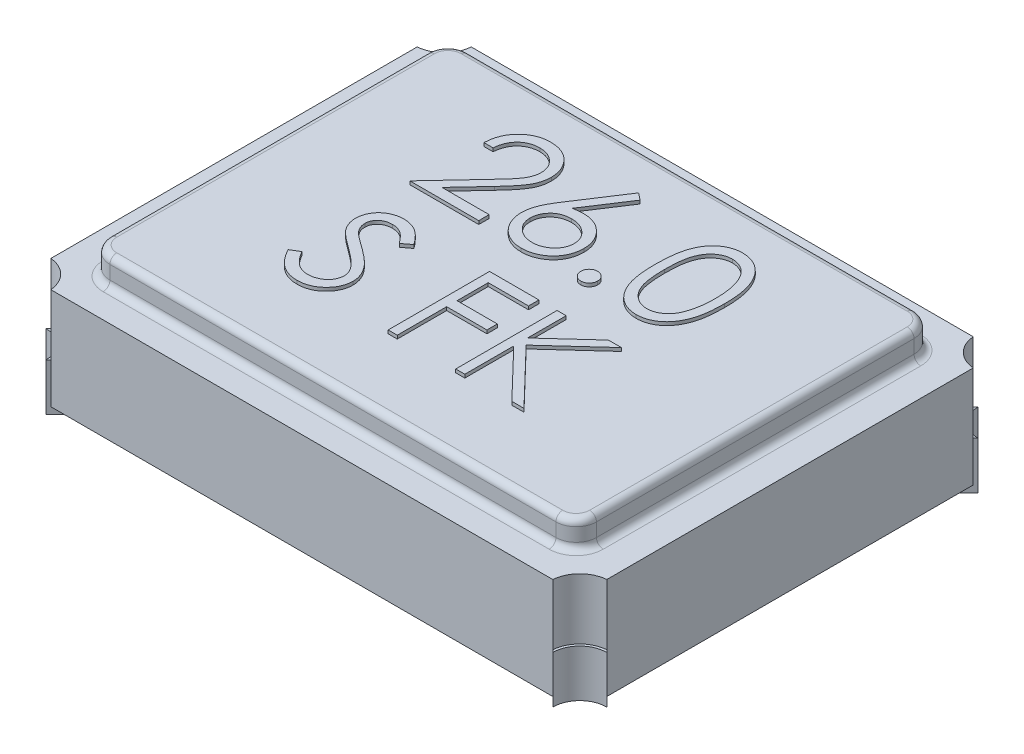
from build123d import *

# Parameters (mm, degrees)
EXTRUDE_2_DEPTH   = 0.02
EXTRUDE_2_2_DEPTH = 0.02
EXTRUDE_2_3_DEPTH = 0.02
EXTRUDE_2_4_DEPTH = 0.02
EXTRUDE_4_DEPTH   = 0.12
EXTRUDE_8_DEPTH   = 0.3
SKETCH_7_W        = 1.44
SKETCH_7_H        = 1.06
EXTRUDE_9_DEPTH   = 0.08
FILLET_3_R        = 0.06
FILLET_4_R        = 0.02
FILLET_5_R        = 0.02
EXTRUDE_10_DEPTH  = 0.01


with BuildPart() as part:
    # Эскиз2 → Бобышка-Вытянуть2 (new body)
    with BuildSketch(Plane(origin=(0, 0, 0), x_dir=(1, 0, 0), z_dir=(0, 1, 0))):
        with BuildLine():
            Line((-0.74501601, 0.156657181), (-0.74501601, 0.464330546))
            Line((-0.74501601, 0.464330546), (-0.83001601, 0.549330546))
            ThreePointArc((-0.83001601, 0.549330546), (-0.773447468, 0.572762004), (-0.75001601, 0.629330546))
            Line((-0.75001601, 0.629330546), (-0.662036749, 0.541351285))
            Line((-0.662036749, 0.541351285), (-0.26444153, 0.541351285))
            Line((-0.26444153, 0.541351285), (-0.26444153, 0.331410506))
            Line((-0.26444153, 0.331410506), (-0.439194854, 0.156657181))
            Line((-0.439194854, 0.156657181), (-0.74501601, 0.156657181))
        make_face()
    extrude(amount=EXTRUDE_2_DEPTH)



with BuildPart() as body_2:
    # Эскиз2 → Extrude 2 2 (new body)
    with BuildSketch(Plane(origin=(0, 0, 0), x_dir=(1, 0, 0), z_dir=(0, 1, 0))):
        with BuildLine():
            Line((0.75001601, 0.629330546), (0.662036749, 0.541351285))
            Line((0.662036749, 0.541351285), (0.26444153, 0.541351285))
            Line((0.26444153, 0.541351285), (0.26444153, 0.156657181))
            Line((0.26444153, 0.156657181), (0.74501601, 0.156657181))
            Line((0.74501601, 0.156657181), (0.74501601, 0.464330546))
            Line((0.74501601, 0.464330546), (0.83001601, 0.549330546))
            ThreePointArc((0.83001601, 0.549330546), (0.773447468, 0.572762004), (0.75001601, 0.629330546))
        make_face()
    extrude(amount=EXTRUDE_2_2_DEPTH)


with BuildPart() as body_3:
    # Эскиз2 → Extrude 2 3 (new body)
    with BuildSketch(Plane(origin=(0, 0, 0), x_dir=(1, 0, 0), z_dir=(0, 1, 0))):
        with BuildLine():
            Line((-0.75001601, -0.629330546), (-0.662036749, -0.541351285))
            Line((-0.662036749, -0.541351285), (-0.26444153, -0.541351285))
            Line((-0.26444153, -0.541351285), (-0.26444153, -0.156657181))
            Line((-0.26444153, -0.156657181), (-0.74501601, -0.156657181))
            Line((-0.74501601, -0.156657181), (-0.74501601, -0.464330546))
            Line((-0.74501601, -0.464330546), (-0.83001601, -0.549330546))
            ThreePointArc((-0.83001601, -0.549330546), (-0.773447468, -0.572762004), (-0.75001601, -0.629330546))
        make_face()
    extrude(amount=EXTRUDE_2_3_DEPTH)


with BuildPart() as body_4:
    # Эскиз2 → Extrude 2 4 (new body)
    with BuildSketch(Plane(origin=(0, 0, 0), x_dir=(1, 0, 0), z_dir=(0, 1, 0))):
        with BuildLine():
            Line((0.26444153, -0.156657181), (0.26444153, -0.541351285))
            Line((0.26444153, -0.541351285), (0.662036749, -0.541351285))
            Line((0.662036749, -0.541351285), (0.75001601, -0.629330546))
            ThreePointArc((0.75001601, -0.629330546), (0.773447468, -0.572762004), (0.83001601, -0.549330546))
            Line((0.83001601, -0.549330546), (0.74501601, -0.464330546))
            Line((0.74501601, -0.464330546), (0.74501601, -0.156657181))
            Line((0.74501601, -0.156657181), (0.26444153, -0.156657181))
        make_face()
    extrude(amount=EXTRUDE_2_4_DEPTH)


with BuildPart() as part_1:
    add(part.part)

    add(body_2.part)  # Бобышка-Вытянуть4 merges body 2

    add(body_3.part)  # Бобышка-Вытянуть4 merges body 3

    add(body_4.part)  # Бобышка-Вытянуть4 merges body 4
    # Эскиз5 → Бобышка-Вытянуть4 (add)
    with BuildSketch(Plane(origin=(0, 0.02, 0), x_dir=(-1, 0, 0), z_dir=(0, 1, 0))):
        with BuildLine():
            Line((0.75001601, -0.629330546), (0.742944942, -0.622259479))
            ThreePointArc((0.742944942, -0.622259479), (0.768244775, -0.567559312), (0.822944942, -0.542259479))
            Line((0.822944942, -0.542259479), (0.83001601, -0.549330546))
            ThreePointArc((0.83001601, -0.549330546), (0.773447468, -0.572762004), (0.75001601, -0.629330546))
        make_face()
        with BuildLine():
            Line((-0.83001601, -0.549330546), (-0.822944942, -0.542259479))
            ThreePointArc((-0.822944942, -0.542259479), (-0.768244775, -0.567559312), (-0.742944942, -0.622259479))
            Line((-0.742944942, -0.622259479), (-0.75001601, -0.629330546))
            ThreePointArc((-0.75001601, -0.629330546), (-0.773447468, -0.572762004), (-0.83001601, -0.549330546))
        make_face()
        with BuildLine():
            Line((-0.75001601, 0.629330546), (-0.742944942, 0.622259479))
            ThreePointArc((-0.742944942, 0.622259479), (-0.768244775, 0.567559312), (-0.822944942, 0.542259479))
            Line((-0.822944942, 0.542259479), (-0.83001601, 0.549330546))
            ThreePointArc((-0.83001601, 0.549330546), (-0.773447468, 0.572762004), (-0.75001601, 0.629330546))
        make_face()
        with BuildLine():
            Line((0.83001601, 0.549330546), (0.822944942, 0.542259479))
            ThreePointArc((0.822944942, 0.542259479), (0.768244775, 0.567559312), (0.742944942, 0.622259479))
            Line((0.742944942, 0.622259479), (0.75001601, 0.629330546))
            ThreePointArc((0.75001601, 0.629330546), (0.773447468, 0.572762004), (0.83001601, 0.549330546))
        make_face()
    extrude(amount=EXTRUDE_4_DEPTH)

    # Эскиз6 → Бобышка-Вытянуть8 (add)
    with BuildSketch(Plane(origin=(0, 0.02, 0), x_dir=(-1, 0, 0), z_dir=(0, 1, 0))):
        with BuildLine():
            Line((0.822944942, -0.542259479), (0.822944942, 0.542259479))
            ThreePointArc((0.822944942, 0.542259479), (0.768244775, 0.567559312), (0.742944942, 0.622259479))
            Line((0.742944942, 0.622259479), (-0.742944942, 0.622259479))
            ThreePointArc((-0.742944942, 0.622259479), (-0.768244775, 0.567559312), (-0.822944942, 0.542259479))
            Line((-0.822944942, 0.542259479), (-0.822944942, -0.542259479))
            ThreePointArc((-0.822944942, -0.542259479), (-0.768244775, -0.567559312), (-0.742944942, -0.622259479))
            Line((-0.742944942, -0.622259479), (0.742944942, -0.622259479))
            ThreePointArc((0.742944942, -0.622259479), (0.768244775, -0.567559312), (0.822944942, -0.542259479))
        make_face()
    extrude(amount=EXTRUDE_8_DEPTH)

    # Эскиз7 → Бобышка-Вытянуть9 (add)
    with BuildSketch(Plane(origin=(0, 0.32, 0), x_dir=(-1, 0, 0), z_dir=(0, 1, 0))):
        Rectangle(SKETCH_7_W, SKETCH_7_H)
    extrude(amount=EXTRUDE_9_DEPTH)

    # Скругление3
    fillet_3_edges = [part_1.edges().sort_by_distance(p)[0] for p in [
        (-0.72, 0.36, -0.53),
        (-0.72, 0.36, 0.53),
        (0.72, 0.36, 0.53),
        (0.72, 0.36, -0.53),
    ]]
    fillet(fillet_3_edges, radius=FILLET_3_R)

    # Скругление4
    fillet_4_edges = [part_1.edges().sort_by_distance(p)[0] for p in [
        (0, 0.4, -0.53),
        (0.72, 0.4, 0),
        (-0.72, 0.4, 0),
        (0, 0.4, 0.53),
        (-0.702426407, 0.4, 0.512426407),
        (-0.702426407, 0.4, -0.512426407),
        (0.702426407, 0.4, 0.512426407),
        (0.702426407, 0.4, -0.512426407),
    ]]
    fillet(fillet_4_edges, radius=FILLET_4_R)

    # Скругление5
    fillet_5_edges = [part_1.edges().sort_by_distance(p)[0] for p in [
        (0, 0.32, -0.53),
        (0.72, 0.32, 0),
        (0, 0.32, 0.53),
        (-0.72, 0.32, 0),
        (0.702426407, 0.32, -0.512426407),
        (0.702426407, 0.32, 0.512426407),
        (-0.702426407, 0.32, -0.512426407),
        (-0.702426407, 0.32, 0.512426407),
    ]]
    fillet(fillet_5_edges, radius=FILLET_5_R)

    # Эскиз8 → Бобышка-Вытянуть10 (add)
    # profile 1 of 7: a face of its own
    with BuildSketch(Plane(origin=(0, 0.4, 0), x_dir=(-1, 0, 0), z_dir=(0, 1, 0))):
        with BuildLine():
            Line((0.404202139, 0.258273988), (0.378841562, 0.243069661))
            add(Edge.make_bspline(
                [(0.378841562, 0.243069661), (0.376482856, 0.247018037), (0.371963666, 0.254582973), (0.364424978, 0.264805091), (0.356613586, 0.273493276), (0.348471643, 0.280596985), (0.340048848, 0.286189746), (0.331290214, 0.290149938), (0.322225259, 0.292619878), (0.316056075, 0.292919886), (0.312976178, 0.293069661)],
                knots=[0, 0, 0, 0, 1.272034388, 2.437168799, 3.508375237, 4.49857839, 5.41946034, 6.295179144, 7.148887113, 8, 8, 8, 8], degree=3))
            add(Edge.make_bspline(
                [(0.312976178, 0.293069661), (0.310346407, 0.292994661), (0.305132882, 0.292845972), (0.297442695, 0.291474988), (0.290011336, 0.289232068), (0.282912768, 0.286191521), (0.276334729, 0.282454119), (0.27047482, 0.2780467), (0.265523603, 0.272955223), (0.26143029, 0.267363266), (0.258225977, 0.261387555), (0.255946032, 0.255175256), (0.254481445, 0.248765956), (0.254295756, 0.244419583), (0.254202139, 0.242228315)],
                knots=[0, 0, 0, 0, 1.095645842, 2.172120455, 3.244862764, 4.326153987, 5.384857088, 6.392105572, 7.372507978, 8.334705661, 9.272564127, 10.189475455, 11.087205874, 12, 12, 12, 12], degree=3))
            add(Edge.make_bspline(
                [(0.254202139, 0.242228315), (0.254325794, 0.239729694), (0.25457621, 0.234669715), (0.256783139, 0.227191536), (0.260153027, 0.219759057), (0.263320343, 0.215160723), (0.264959351, 0.2127812)],
                knots=[0, 0, 0, 0, 0.938992559, 1.901562324, 2.914110574, 4, 4, 4, 4], degree=3))
            add(Edge.make_bspline(
                [(0.264959351, 0.2127812), (0.266298546, 0.21105917), (0.269118272, 0.207433373), (0.274037181, 0.202131026), (0.27963029, 0.196516819), (0.286042407, 0.190702812), (0.29318003, 0.184570072), (0.301124079, 0.178232341), (0.309781795, 0.171595093), (0.315888334, 0.167211381), (0.319045889, 0.164944661)],
                knots=[0, 0, 0, 0, 0.722283655, 1.520795216, 2.39349503, 3.346893347, 4.386874146, 5.510198126, 6.712579003, 8, 8, 8, 8], degree=3))
            add(Edge.make_bspline(
                [(0.319045889, 0.164944661), (0.322201811, 0.162695982), (0.328235692, 0.158396679), (0.336680442, 0.152024107), (0.344221783, 0.146160636), (0.350898142, 0.140887944), (0.356536792, 0.135976061), (0.361343867, 0.131688237), (0.365142017, 0.127795506), (0.367255597, 0.125272252), (0.368204543, 0.124139373)],
                knots=[0, 0, 0, 0, 1.452255772, 2.776602448, 3.96446981, 5.032613149, 5.964194703, 6.766668629, 7.446264616, 8, 8, 8, 8], degree=3))
            add(Edge.make_bspline(
                [(0.368204543, 0.124139373), (0.369530539, 0.122373482), (0.372138288, 0.118900621), (0.375584256, 0.113474025), (0.37849025, 0.107929589), (0.380829032, 0.102247219), (0.382720316, 0.09646962), (0.384035244, 0.090553418), (0.384845738, 0.084538775), (0.38492946, 0.080492044), (0.38497137, 0.078466296)],
                knots=[0, 0, 0, 0, 1.068019517, 2.100403715, 3.106014851, 4.09224787, 5.069873182, 6.043214339, 7.020455327, 8, 8, 8, 8], degree=3))
            add(Edge.make_bspline(
                [(0.38497137, 0.078466296), (0.384859988, 0.075292043), (0.384639604, 0.069011385), (0.382760408, 0.05984126), (0.379829366, 0.051059099), (0.375588822, 0.042860362), (0.370350956, 0.035256672), (0.364133599, 0.02838291), (0.356820317, 0.022475681), (0.348678768, 0.017454064), (0.339871289, 0.013447934), (0.330615145, 0.010528817), (0.320951928, 0.008818036), (0.314385131, 0.008576721), (0.311053101, 0.008454277)],
                knots=[0, 0, 0, 0, 1.005367131, 1.989245246, 2.955191616, 3.932180104, 4.904534562, 5.875498653, 6.859376768, 7.874484044, 8.900379497, 9.918679785, 10.943926428, 12, 12, 12, 12], degree=3))
            add(Edge.make_bspline(
                [(0.311053101, 0.008454277), (0.3075168, 0.00857228), (0.300503892, 0.008806293), (0.290185218, 0.010966122), (0.280191117, 0.014321933), (0.27218163, 0.018318638), (0.26591072, 0.022267377), (0.261133506, 0.025873167), (0.256266095, 0.030015346), (0.251360932, 0.034781662), (0.246369551, 0.04007666), (0.241314957, 0.045945198), (0.236149844, 0.052334382), (0.2328281, 0.056896677), (0.231125216, 0.059235527)],
                knots=[0, 0, 0, 0, 1.286534051, 2.551350862, 3.822568981, 5.117864672, 5.799956111, 6.519305446, 7.295594771, 8.126302591, 9.008831062, 9.944975596, 10.946496709, 12, 12, 12, 12], degree=3))
            Line((0.231125216, 0.059235527), (0.255464158, 0.077685046))
            add(Edge.make_bspline(
                [(0.255464158, 0.077685046), (0.256933703, 0.07579162), (0.259763701, 0.072145324), (0.26406194, 0.06704067), (0.268106993, 0.062371459), (0.27212285, 0.058326561), (0.275799955, 0.054603035), (0.279432226, 0.051471778), (0.282879343, 0.048833381), (0.287214476, 0.046014028), (0.292720108, 0.043286283), (0.299566881, 0.040941072), (0.306726675, 0.039499801), (0.311587301, 0.039316618), (0.314057908, 0.039223507)],
                knots=[0, 0, 0, 0, 1.181426797, 2.275151783, 3.28963443, 4.225459815, 5.084396437, 5.868484344, 6.587427557, 7.222918358, 8.415355282, 9.605213164, 10.782753814, 12, 12, 12, 12], degree=3))
            add(Edge.make_bspline(
                [(0.314057908, 0.039223507), (0.31715777, 0.039325667), (0.323135562, 0.039522671), (0.331602504, 0.041730875), (0.339267199, 0.0450883), (0.34583705, 0.049929671), (0.351261673, 0.055701518), (0.355234333, 0.062283903), (0.357609516, 0.069553891), (0.357900235, 0.074622775), (0.358048293, 0.077204277)],
                knots=[0, 0, 0, 0, 1.144248881, 2.206576175, 3.214949548, 4.222996039, 5.203671638, 6.127710127, 7.046472867, 8, 8, 8, 8], degree=3))
            add(Edge.make_bspline(
                [(0.358048293, 0.077204277), (0.358011079, 0.078810755), (0.357936133, 0.082046092), (0.357042592, 0.086816254), (0.35570917, 0.091530261), (0.353819081, 0.096215271), (0.351250428, 0.101004757), (0.347761746, 0.10587142), (0.343396123, 0.110937059), (0.340045622, 0.114228509), (0.338276658, 0.115966296)],
                knots=[0, 0, 0, 0, 0.858500039, 1.728959331, 2.587258638, 3.476905708, 4.426389682, 5.487945037, 6.673710648, 8, 8, 8, 8], degree=3))
            add(Edge.make_bspline(
                [(0.338276658, 0.115966296), (0.337619969, 0.116552327), (0.336059826, 0.117944602), (0.333207604, 0.12022394), (0.329441079, 0.123035606), (0.324858604, 0.126514519), (0.319375688, 0.130550073), (0.312991726, 0.135090668), (0.30577788, 0.140283708), (0.300658859, 0.143914354), (0.297952139, 0.145834084)],
                knots=[0, 0, 0, 0, 0.420754252, 0.999615792, 1.744751191, 2.668019286, 3.750313428, 4.999500688, 6.413464383, 8, 8, 8, 8], degree=3))
            add(Edge.make_bspline(
                [(0.297952139, 0.145834084), (0.294696206, 0.148203345), (0.288391543, 0.152791091), (0.279420862, 0.159683841), (0.271287213, 0.166425156), (0.263961439, 0.172971548), (0.25737318, 0.179274823), (0.25158885, 0.185405929), (0.246582205, 0.191324659), (0.241118583, 0.198861238), (0.235601945, 0.208203103), (0.230871881, 0.21965381), (0.227862695, 0.231137376), (0.227471885, 0.238845739), (0.227279062, 0.242648988)],
                knots=[0, 0, 0, 0, 1.163604038, 2.253157948, 3.268574773, 4.215621239, 5.091738613, 5.902582348, 6.650434646, 7.330118262, 8.591011492, 9.77460283, 10.902005569, 12, 12, 12, 12], degree=3))
            add(Edge.make_bspline(
                [(0.227279062, 0.242648988), (0.227335477, 0.245338513), (0.227447211, 0.250665333), (0.228728285, 0.258487919), (0.230611912, 0.266082163), (0.233419231, 0.273353556), (0.236928461, 0.28038314), (0.241200921, 0.287158589), (0.246378656, 0.293568575), (0.252130498, 0.299737581), (0.258519339, 0.305316837), (0.265280038, 0.310286193), (0.272374647, 0.314541067), (0.279884187, 0.31788379), (0.287684955, 0.320557682), (0.295813567, 0.322474258), (0.304287491, 0.323654547), (0.310047616, 0.323776758), (0.312976178, 0.323838892)],
                knots=[0, 0, 0, 0, 0.98378539, 1.948466333, 2.894822735, 3.844243623, 4.795447569, 5.768042124, 6.770299647, 7.807997672, 8.852593179, 9.870666288, 10.876941106, 11.874841786, 12.874492863, 13.892063892, 14.928283473, 16, 16, 16, 16], degree=3))
            add(Edge.make_bspline(
                [(0.312976178, 0.323838892), (0.315241964, 0.323794574), (0.319745002, 0.323706497), (0.326387662, 0.322946286), (0.332908342, 0.321831427), (0.339225169, 0.320131672), (0.345416792, 0.31802084), (0.351428048, 0.315436452), (0.357273438, 0.312359797), (0.362960183, 0.308786115), (0.368540331, 0.304666499), (0.373991364, 0.299909969), (0.379340568, 0.294539291), (0.384610163, 0.28856194), (0.389676017, 0.281879114), (0.394665522, 0.274596795), (0.399552697, 0.266691457), (0.402623378, 0.261132218), (0.404202139, 0.258273988)],
                knots=[0, 0, 0, 0, 0.915366252, 1.81920441, 2.69897508, 3.586533125, 4.459536084, 5.340758185, 6.227946952, 7.126403341, 8.052553006, 9.028121456, 10.047063623, 11.114014537, 12.24582441, 13.433687931, 14.680555077, 16, 16, 16, 16], degree=3))
        make_face()
    # profile 2 of 7: a face of its own
    with BuildSketch(Plane(origin=(0, 0.4, 0), x_dir=(-1, 0, 0), z_dir=(0, 1, 0))):
        Polygon((0.050355985, 0.016146584), (-0.095797861, 0.016146584), (-0.095797861, 0.046915815), (0.023432908, 0.046915815), (0.023432908, 0.139223507), (-0.095797861, 0.139223507), (-0.095797861, 0.169992738), (0.023432908, 0.169992738), (0.023432908, 0.316146584), (0.050355985, 0.316146584), align=None)
    # profile 3 of 7: a face of its own
    with BuildSketch(Plane(origin=(0, 0.4, 0), x_dir=(-1, 0, 0), z_dir=(0, 1, 0))):
        Polygon((-0.149644015, 0.016146584), (-0.176567092, 0.016146584), (-0.176567092, 0.130389373), (-0.301627188, 0.016146584), (-0.34002863, 0.016146584), (-0.192612765, 0.150761969), (-0.351567092, 0.316146584), (-0.315689688, 0.316146584), (-0.176567092, 0.17137495), (-0.176567092, 0.316146584), (-0.149644015, 0.316146584), align=None)
    # profile 4 of 7: a face of its own
    with BuildSketch(Plane(origin=(0, 0.4, 0), x_dir=(-1, 0, 0), z_dir=(0, 1, 0))):
        with BuildLine():
            Line((0.361894447, -0.305791791), (0.388817524, -0.305791791))
            add(Edge.make_bspline(
                [(0.388817524, -0.305791791), (0.388642083, -0.309363599), (0.388297523, -0.316378535), (0.386683247, -0.326606049), (0.384375559, -0.336383077), (0.381105026, -0.345625797), (0.377066203, -0.354444622), (0.372121516, -0.362722448), (0.366376376, -0.370541433), (0.359841324, -0.377753535), (0.35275019, -0.384346298), (0.345145461, -0.390099734), (0.3371053, -0.394905207), (0.328699443, -0.398944318), (0.319830674, -0.40197248), (0.310583768, -0.404220313), (0.300916931, -0.405572499), (0.294330651, -0.405717862), (0.290980985, -0.405791791)],
                knots=[0, 0, 0, 0, 1.100776268, 2.161895295, 3.184016182, 4.190939212, 5.176500551, 6.166955529, 7.155448256, 8.160289653, 9.16017456, 10.133824356, 11.091467644, 12.04088621, 13.000931625, 13.972173743, 14.968683325, 16, 16, 16, 16], degree=3))
            add(Edge.make_bspline(
                [(0.290980985, -0.405791791), (0.287691205, -0.405715406), (0.281226903, -0.405565311), (0.271796291, -0.404256953), (0.262797225, -0.402252012), (0.254331692, -0.399281004), (0.246312812, -0.39555304), (0.238839871, -0.390916828), (0.231732167, -0.385591738), (0.225338532, -0.379310533), (0.219465207, -0.372608472), (0.214402756, -0.365450727), (0.210042934, -0.358049398), (0.206474555, -0.35034667), (0.203769566, -0.34231746), (0.201765428, -0.334038746), (0.200619754, -0.325414985), (0.200444888, -0.319577113), (0.200355985, -0.316609099)],
                knots=[0, 0, 0, 0, 1.111674182, 2.184400057, 3.212814286, 4.223731311, 5.211378316, 6.196328225, 7.191884489, 8.207283132, 9.220262353, 10.201199469, 11.166417575, 12.120932471, 13.06540007, 14.026332106, 14.996573967, 16, 16, 16, 16], degree=3))
            add(Edge.make_bspline(
                [(0.200355985, -0.316609099), (0.200501124, -0.312430715), (0.200788856, -0.304147272), (0.203250054, -0.291974543), (0.207094168, -0.280180921), (0.211722103, -0.270688829), (0.216392088, -0.263040968), (0.220596213, -0.256740988), (0.225545826, -0.249959389), (0.231198641, -0.242668721), (0.237652006, -0.234964463), (0.244738264, -0.226689426), (0.252640421, -0.217996623), (0.258181732, -0.212055453), (0.261053101, -0.208976887)],
                knots=[0, 0, 0, 0, 1.184416499, 2.348048165, 3.509039915, 4.696071444, 5.333504901, 6.05069495, 6.844171097, 7.714965912, 8.667477798, 9.695072654, 10.805644396, 12, 12, 12, 12], degree=3))
            Line((0.261053101, -0.208976887), (0.336113197, -0.128868714))
            Line((0.336113197, -0.128868714), (0.196509831, -0.128868714))
            Line((0.196509831, -0.128868714), (0.196509831, -0.098099484))
            Line((0.196509831, -0.098099484), (0.400355985, -0.098099484))
            Line((0.400355985, -0.098099484), (0.284009831, -0.222258137))
            add(Edge.make_bspline(
                [(0.284009831, -0.222258137), (0.281176955, -0.225214974), (0.275735579, -0.230894451), (0.268042568, -0.239188827), (0.261121893, -0.246874599), (0.254968963, -0.253985824), (0.249578715, -0.260482189), (0.244968396, -0.266414603), (0.241117629, -0.271732158), (0.237036618, -0.277978998), (0.233145104, -0.285615072), (0.229724861, -0.294899815), (0.227654292, -0.304478866), (0.22740464, -0.310950144), (0.227279062, -0.314205253)],
                knots=[0, 0, 0, 0, 1.329530082, 2.553755191, 3.672934919, 4.687409497, 5.60679272, 6.413407421, 7.126401618, 7.737995624, 8.834647426, 9.90044882, 10.943907757, 12, 12, 12, 12], degree=3))
            add(Edge.make_bspline(
                [(0.227279062, -0.314205253), (0.227332995, -0.316252456), (0.227439285, -0.3202871), (0.228395119, -0.326198634), (0.229799429, -0.331923108), (0.231963904, -0.337389744), (0.234564441, -0.342706058), (0.237886819, -0.34771042), (0.241683425, -0.352573415), (0.246087301, -0.357128296), (0.250921939, -0.361301273), (0.256030184, -0.364997544), (0.261434435, -0.368086632), (0.267112171, -0.370618926), (0.273047494, -0.372605389), (0.279251902, -0.373981838), (0.285708246, -0.374846051), (0.290116831, -0.37496298), (0.292363197, -0.37502256)],
                knots=[0, 0, 0, 0, 0.991504627, 1.954065223, 2.895985987, 3.842598665, 4.797835564, 5.759220273, 6.74786863, 7.784730864, 8.824135544, 9.839918996, 10.835834653, 11.835434876, 12.84861661, 13.863796685, 14.911511676, 16, 16, 16, 16], degree=3))
            add(Edge.make_bspline(
                [(0.292363197, -0.37502256), (0.294709867, -0.374963709), (0.299318341, -0.374848134), (0.306070061, -0.373972174), (0.312556063, -0.372645576), (0.318676399, -0.370533643), (0.324559157, -0.368061901), (0.330054266, -0.364861431), (0.335316089, -0.361204399), (0.340238836, -0.356940531), (0.344722395, -0.352127267), (0.348801129, -0.346888114), (0.35225708, -0.341130192), (0.355324893, -0.334991666), (0.357671165, -0.328303883), (0.359677059, -0.321230402), (0.361134111, -0.313670301), (0.361636792, -0.308461579), (0.361894447, -0.305791791)],
                knots=[0, 0, 0, 0, 1.031072318, 2.024855787, 2.988461151, 3.935103592, 4.865765533, 5.788564469, 6.724086513, 7.67908574, 8.64457978, 9.611397706, 10.591395687, 11.591555111, 12.622101007, 13.700900657, 14.821571223, 16, 16, 16, 16], degree=3))
        make_face()
    # profile 5 of 7: a face of its own
    with BuildSketch(Plane(origin=(0, 0.4, 0), x_dir=(-1, 0, 0), z_dir=(0, 1, 0))):
        with BuildLine():
            Line((0.031125216, -0.405791791), (0.010392043, -0.389505734))
            Line((0.010392043, -0.389505734), (0.08965887, -0.268291791))
            add(Edge.make_bspline(
                [(0.08965887, -0.268291791), (0.084381418, -0.269132979), (0.07408715, -0.270773812), (0.063667216, -0.271044493), (0.058589158, -0.271176407)],
                knots=[0, 0, 0, 0, 1.025318673, 2, 2, 2, 2], degree=3))
            add(Edge.make_bspline(
                [(0.058589158, -0.271176407), (0.055540087, -0.271094454), (0.049538081, -0.270933133), (0.04072607, -0.26969166), (0.032258447, -0.267735222), (0.02417031, -0.264883314), (0.016432621, -0.261240257), (0.009001004, -0.256874061), (0.002015052, -0.251559317), (-0.004614799, -0.24562221), (-0.010635195, -0.239046881), (-0.015961206, -0.232068131), (-0.020459467, -0.22468651), (-0.024043256, -0.21690368), (-0.026907339, -0.208780563), (-0.028946217, -0.200285479), (-0.030165089, -0.191404089), (-0.030329652, -0.185362922), (-0.030413245, -0.182294195)],
                knots=[0, 0, 0, 0, 1.043709831, 2.054511743, 3.041122595, 4.01515914, 4.98481438, 5.965901842, 6.960491961, 7.985277438, 9.0096037, 10.00832444, 10.987059228, 11.962929573, 12.936966118, 13.931840027, 14.949438142, 16, 16, 16, 16], degree=3))
            add(Edge.make_bspline(
                [(-0.030413245, -0.182294195), (-0.03025698, -0.178098275), (-0.029949668, -0.169846565), (-0.027704156, -0.157780435), (-0.023857475, -0.146384344), (-0.018628363, -0.135628534), (-0.011973185, -0.125738257), (-0.003990802, -0.116829821), (0.005279376, -0.109064874), (0.015652775, -0.102406567), (0.026878498, -0.09711579), (0.038649436, -0.093204406), (0.05086449, -0.09086721), (0.05916021, -0.090561226), (0.063336755, -0.090407176)],
                knots=[0, 0, 0, 0, 1.0319111, 2.029359566, 3.00642934, 3.98275322, 4.962714161, 5.929339302, 6.915525103, 7.928435063, 8.953439721, 9.960121214, 10.9730072, 12, 12, 12, 12], degree=3))
            add(Edge.make_bspline(
                [(0.063336755, -0.090407176), (0.067373785, -0.090537792), (0.075370436, -0.090796521), (0.087130751, -0.093113336), (0.098451045, -0.096841763), (0.109185746, -0.10208614), (0.119147085, -0.108598214), (0.128127439, -0.116384503), (0.13589957, -0.125450058), (0.142391247, -0.135625713), (0.147703618, -0.146473888), (0.151415451, -0.157908514), (0.153828778, -0.169692613), (0.154077129, -0.177715109), (0.154202139, -0.18175333)],
                knots=[0, 0, 0, 0, 1.01206923, 2.004731945, 2.994948482, 3.995280086, 4.993424783, 5.973125358, 6.967517142, 7.97830003, 8.994392566, 9.989381197, 10.98793077, 12, 12, 12, 12], degree=3))
            add(Edge.make_bspline(
                [(0.154202139, -0.18175333), (0.154093415, -0.18484174), (0.15387152, -0.191144879), (0.152547275, -0.200718774), (0.150118449, -0.210476537), (0.147489928, -0.21874845), (0.144881642, -0.225599092), (0.142463179, -0.231008864), (0.139759042, -0.236721757), (0.136589418, -0.242629676), (0.13322936, -0.248901426), (0.129304431, -0.255304743), (0.125208708, -0.262073496), (0.122208285, -0.266580026), (0.120668485, -0.268892753)],
                knots=[0, 0, 0, 0, 1.17367173, 2.395347028, 3.66355231, 4.98980831, 5.690886799, 6.447442954, 7.240630024, 8.091733897, 8.994365608, 9.943299771, 10.944512865, 12, 12, 12, 12], degree=3))
            Line((0.120668485, -0.268892753), (0.031125216, -0.405791791))
        make_face()
        with BuildLine():
            add(Edge.make_bspline(
                [(0.064238197, -0.240407176), (0.066523686, -0.240340252), (0.071007798, -0.240208948), (0.0775745, -0.239450993), (0.083793177, -0.238063722), (0.089653622, -0.236111001), (0.095242326, -0.23372528), (0.100470517, -0.230699891), (0.105373379, -0.2271421), (0.109837691, -0.223047131), (0.113938107, -0.218632161), (0.117464864, -0.213874225), (0.120510432, -0.208919604), (0.122985808, -0.203721491), (0.124913585, -0.198283282), (0.126307991, -0.192629615), (0.127084031, -0.186722679), (0.127213136, -0.182717035), (0.127279062, -0.180671599)],
                knots=[0, 0, 0, 0, 1.129540697, 2.216149546, 3.260829642, 4.271906843, 5.264942922, 6.258225651, 7.250175744, 8.252297429, 9.247108021, 10.223125336, 11.173816288, 12.116901384, 13.062424938, 14.020354563, 14.989116641, 16, 16, 16, 16], degree=3))
            add(Edge.make_bspline(
                [(0.127279062, -0.180671599), (0.127223335, -0.178644889), (0.127113517, -0.174651008), (0.12618283, -0.168787072), (0.124684714, -0.163162115), (0.122555032, -0.157764272), (0.119834306, -0.15260175), (0.116580175, -0.147612141), (0.11263426, -0.142928261), (0.108151619, -0.138521203), (0.103280711, -0.134488386), (0.098140093, -0.130882808), (0.09271132, -0.127890107), (0.087052207, -0.125388634), (0.081091658, -0.123550878), (0.07493061, -0.122142947), (0.068484165, -0.121373435), (0.06411985, -0.121242945), (0.061894447, -0.121176407)],
                knots=[0, 0, 0, 0, 0.98953633, 1.950002717, 2.892353065, 3.828177645, 4.777967117, 5.738732544, 6.732276577, 7.76327951, 8.805689376, 9.818183401, 10.825652611, 11.829169732, 12.834974292, 13.867693979, 14.912718532, 16, 16, 16, 16], degree=3))
            add(Edge.make_bspline(
                [(0.061894447, -0.121176407), (0.05966904, -0.12124294), (0.055304718, -0.12137342), (0.048858324, -0.122143006), (0.042697085, -0.123550664), (0.036737232, -0.125389408), (0.031075537, -0.127887217), (0.025642015, -0.130901672), (0.020452314, -0.134466528), (0.015584574, -0.138528177), (0.011083225, -0.142903261), (0.007227982, -0.147654956), (0.003868906, -0.152562482), (0.001251941, -0.157784806), (-0.000901586, -0.163158905), (-0.002392363, -0.168787948), (-0.003325034, -0.17465078), (-0.003434579, -0.178644812), (-0.003490169, -0.180671599)],
                knots=[0, 0, 0, 0, 1.087095469, 2.131941252, 3.164484274, 4.170116773, 5.173462224, 6.180759088, 7.201132453, 8.243363996, 9.274190558, 10.261329848, 11.227346438, 12.172477233, 13.108141724, 14.050330866, 15.010632948, 16, 16, 16, 16], degree=3))
            add(Edge.make_bspline(
                [(-0.003490169, -0.180671599), (-0.00344355, -0.182719941), (-0.003352054, -0.18674017), (-0.002297139, -0.192624293), (-0.000872301, -0.198329255), (0.001430369, -0.20372654), (0.004173032, -0.20896542), (0.007667026, -0.213896101), (0.011672895, -0.218658517), (0.016312391, -0.223076395), (0.021358581, -0.227120198), (0.026729118, -0.230679081), (0.032325058, -0.233717055), (0.038225497, -0.236114233), (0.044350974, -0.238045434), (0.050743805, -0.239441701), (0.057408532, -0.240210129), (0.061932645, -0.240340657), (0.064238197, -0.240407176)],
                knots=[0, 0, 0, 0, 0.978317929, 1.920119929, 2.851929572, 3.784133089, 4.71845084, 5.67514162, 6.667477147, 7.690549442, 8.733345855, 9.756283585, 10.767808623, 11.772962645, 12.797066014, 13.836159554, 14.89727653, 16, 16, 16, 16], degree=3))
        make_face(mode=Mode.SUBTRACT)
    # profile 6 of 7: a face of its own
    with BuildSketch(Plane(origin=(0, 0.4, 0), x_dir=(-1, 0, 0), z_dir=(0, 1, 0))):
        with BuildLine():
            add(Edge.make_bspline(
                [(-0.109259399, -0.14425333), (-0.110931145, -0.144157339), (-0.11418914, -0.143970266), (-0.118906815, -0.142595373), (-0.123217918, -0.140275534), (-0.127034286, -0.137088051), (-0.130206177, -0.13328263), (-0.13255271, -0.128982478), (-0.133990624, -0.124251126), (-0.134168362, -0.120946134), (-0.134259399, -0.11925333)],
                knots=[0, 0, 0, 0, 1.020591893, 1.988988293, 2.974634352, 3.991697318, 5.008760285, 5.983632262, 6.967224335, 8, 8, 8, 8], degree=3))
            add(Edge.make_bspline(
                [(-0.134259399, -0.11925333), (-0.134165043, -0.117600946), (-0.133978653, -0.114336844), (-0.132552036, -0.10964541), (-0.130209152, -0.105340376), (-0.127014202, -0.10154396), (-0.123240978, -0.098279763), (-0.118893148, -0.095992111), (-0.114201303, -0.094516466), (-0.110933338, -0.09434246), (-0.109259399, -0.09425333)],
                knots=[0, 0, 0, 0, 1.010056097, 1.99525427, 2.971718109, 3.990441831, 5.01702829, 6.004283803, 6.977741589, 8, 8, 8, 8], degree=3))
            add(Edge.make_bspline(
                [(-0.109259399, -0.09425333), (-0.107586666, -0.094345817), (-0.104301841, -0.09452744), (-0.099592439, -0.095962774), (-0.095270948, -0.098302085), (-0.091496744, -0.101538069), (-0.088327476, -0.105360146), (-0.085875823, -0.109616099), (-0.08456303, -0.114350412), (-0.084361564, -0.117603618), (-0.084259399, -0.11925333)],
                knots=[0, 0, 0, 0, 1.021821805, 2.006599202, 2.982645994, 4.008793999, 5.027082625, 6.009034913, 6.990375297, 8, 8, 8, 8], degree=3))
            add(Edge.make_bspline(
                [(-0.084259399, -0.11925333), (-0.084358521, -0.120943367), (-0.084551713, -0.124237339), (-0.085875226, -0.129011761), (-0.088330456, -0.133262839), (-0.091476726, -0.137093896), (-0.095293775, -0.140253562), (-0.099579032, -0.142624305), (-0.104313814, -0.143959448), (-0.10758881, -0.144154058), (-0.109259399, -0.14425333)],
                knots=[0, 0, 0, 0, 1.032329927, 2.012066096, 2.992413168, 4.009037178, 5.025661188, 6.000112418, 6.979848586, 8, 8, 8, 8], degree=3))
        make_face()
    # profile 7 of 7: a face of its own
    with BuildSketch(Plane(origin=(0, 0.4, 0), x_dir=(-1, 0, 0), z_dir=(0, 1, 0))):
        with BuildLine():
            add(Edge.make_bspline(
                [(-0.176567092, -0.247979291), (-0.176595207, -0.252787639), (-0.176649823, -0.262127923), (-0.177257402, -0.275738035), (-0.178266717, -0.28850606), (-0.179649921, -0.300432608), (-0.181333175, -0.31152076), (-0.18358022, -0.32174088), (-0.186135592, -0.331140284), (-0.189097266, -0.339749569), (-0.192438955, -0.347684916), (-0.196076605, -0.355092385), (-0.200152072, -0.361963129), (-0.204441223, -0.36839838), (-0.209094168, -0.374333374), (-0.214094727, -0.379741439), (-0.219398855, -0.384706382), (-0.22503165, -0.389146559), (-0.230939424, -0.393015582), (-0.236947417, -0.396522763), (-0.24322699, -0.39929704), (-0.249623253, -0.401669366), (-0.25618774, -0.403548569), (-0.26292331, -0.404855703), (-0.269836008, -0.405673473), (-0.27450148, -0.405751978), (-0.276867572, -0.405791791)],
                knots=[0, 0, 0, 0, 1.64625301, 3.197870201, 4.6634513, 6.030635694, 7.308242971, 8.501545196, 9.611429483, 10.641742253, 11.616230371, 12.55791849, 13.464870342, 14.34944951, 15.20427819, 16.044004467, 16.869007726, 17.689551165, 18.496129964, 19.285613293, 20.0683943, 20.843080271, 21.620342827, 22.403213977, 23.190190624, 24, 24, 24, 24], degree=3))
            add(Edge.make_bspline(
                [(-0.276867572, -0.405791791), (-0.279254628, -0.405758684), (-0.284004027, -0.405692813), (-0.291000469, -0.404765631), (-0.297875044, -0.403568891), (-0.304523452, -0.401649517), (-0.311071402, -0.399352737), (-0.317356059, -0.396322172), (-0.323599305, -0.393026197), (-0.329517518, -0.389005386), (-0.335287523, -0.384561727), (-0.3406963, -0.379517039), (-0.345882112, -0.374010932), (-0.350649093, -0.367920606), (-0.355201549, -0.361339443), (-0.359366665, -0.354212274), (-0.363231066, -0.346554893), (-0.366867395, -0.338402799), (-0.370047268, -0.329538237), (-0.372874429, -0.320016498), (-0.375191766, -0.309751357), (-0.377108163, -0.298799999), (-0.378595652, -0.287108169), (-0.379678221, -0.274699557), (-0.380250265, -0.261566401), (-0.380357973, -0.252587154), (-0.380413245, -0.247979291)],
                knots=[0, 0, 0, 0, 0.810910589, 1.61342667, 2.396193133, 3.181089899, 3.963115317, 4.752255436, 5.550715454, 6.36105385, 7.181178335, 8.024612154, 8.872680183, 9.750181803, 10.651284446, 11.591556747, 12.554036451, 13.566402641, 14.62422919, 15.753422176, 16.94128843, 18.199818041, 19.531985927, 20.947085226, 22.433341622, 24, 24, 24, 24], degree=3))
            add(Edge.make_bspline(
                [(-0.380413245, -0.247979291), (-0.380356688, -0.243391585), (-0.380246242, -0.234432617), (-0.37969124, -0.221357701), (-0.378566632, -0.2090168), (-0.377195938, -0.197392035), (-0.375219665, -0.1864986), (-0.373019483, -0.176277995), (-0.370213027, -0.166826254), (-0.36710858, -0.158037677), (-0.363522849, -0.149920116), (-0.35968755, -0.142294343), (-0.355460259, -0.135207621), (-0.350995156, -0.128584744), (-0.346137927, -0.12254665), (-0.341022294, -0.116978951), (-0.335561044, -0.111925498), (-0.329761336, -0.107429372), (-0.323787186, -0.103378272), (-0.317542723, -0.099964773), (-0.311174124, -0.096988898), (-0.304615148, -0.094596643), (-0.297907619, -0.092705556), (-0.291027383, -0.091418208), (-0.284003092, -0.09051079), (-0.279254315, -0.090441834), (-0.276867572, -0.090407176)],
                knots=[0, 0, 0, 0, 1.561431216, 3.049195289, 4.452146966, 5.778046447, 7.031138842, 8.218704273, 9.334037798, 10.384210803, 11.388620812, 12.352076869, 13.287433199, 14.19507451, 15.06813243, 15.922055533, 16.766344942, 17.596869952, 18.417486629, 19.220035357, 20.016159057, 20.807716045, 21.59340902, 22.384936649, 23.188266813, 24, 24, 24, 24], degree=3))
            add(Edge.make_bspline(
                [(-0.276867572, -0.090407176), (-0.274501563, -0.090447342), (-0.269836253, -0.090526543), (-0.262922364, -0.091339216), (-0.25619656, -0.092664414), (-0.249645395, -0.094464024), (-0.243255464, -0.096751224), (-0.237089356, -0.099660454), (-0.231065662, -0.103034721), (-0.225211779, -0.106873532), (-0.219639616, -0.111272896), (-0.214315956, -0.116137757), (-0.209380143, -0.121593487), (-0.204759287, -0.127553009), (-0.200434548, -0.134004459), (-0.196376339, -0.140927802), (-0.192749767, -0.148407433), (-0.189332309, -0.156385857), (-0.186319793, -0.165058401), (-0.18368932, -0.174490017), (-0.181471592, -0.184745035), (-0.179705141, -0.195823949), (-0.178258024, -0.207709606), (-0.177258397, -0.220420947), (-0.176650127, -0.233930745), (-0.176595275, -0.243210988), (-0.176567092, -0.247979291)],
                knots=[0, 0, 0, 0, 0.810976328, 1.599087026, 2.383086309, 3.159618043, 3.926613167, 4.707144544, 5.494386734, 6.292609454, 7.104690378, 7.92621526, 8.762510248, 9.62398222, 10.509836085, 11.424023232, 12.373226806, 13.358118208, 14.398657954, 15.5185989, 16.713620699, 17.994156382, 19.364120462, 20.818119981, 22.365111093, 24, 24, 24, 24], degree=3))
        make_face()
        with BuildLine():
            add(Edge.make_bspline(
                [(-0.203490169, -0.248099484), (-0.203500631, -0.244092468), (-0.203520938, -0.236315638), (-0.204036073, -0.225034539), (-0.204753088, -0.214494979), (-0.205655135, -0.204701072), (-0.207006077, -0.195687046), (-0.208538807, -0.187415431), (-0.210377211, -0.179901524), (-0.212563138, -0.173079706), (-0.21505299, -0.166853229), (-0.217767149, -0.16105665), (-0.22070717, -0.155619462), (-0.223940506, -0.150561282), (-0.227513481, -0.145910361), (-0.231346346, -0.141644611), (-0.235461386, -0.137781401), (-0.241156593, -0.133196552), (-0.248638753, -0.128402929), (-0.25811416, -0.124279957), (-0.267854859, -0.121672184), (-0.274468127, -0.121341474), (-0.277769015, -0.121176407)],
                knots=[0, 0, 0, 0, 1.459193451, 2.832007961, 4.111736495, 5.306635028, 6.412683014, 7.430020708, 8.369596877, 9.227877302, 10.036669781, 10.810175692, 11.557788084, 12.286326232, 12.994037279, 13.69140682, 14.37267704, 15.047194847, 16.352618509, 17.594157723, 18.799169539, 20, 20, 20, 20], degree=3))
            add(Edge.make_bspline(
                [(-0.277769015, -0.121176407), (-0.281088856, -0.121321148), (-0.287716763, -0.121610118), (-0.297450832, -0.124132136), (-0.306822531, -0.128232135), (-0.314218577, -0.132916286), (-0.319829742, -0.137405717), (-0.323851533, -0.141228975), (-0.327542473, -0.145511144), (-0.331043248, -0.150131018), (-0.334254019, -0.155177249), (-0.337173718, -0.160625465), (-0.339838005, -0.166490824), (-0.341355923, -0.170585373), (-0.342131995, -0.17267881)],
                knots=[0, 0, 0, 0, 1.353621445, 2.702441307, 4.075953605, 5.516772412, 6.261413105, 7.007624062, 7.778524365, 8.566925914, 9.372323995, 10.217594641, 11.088702136, 12, 12, 12, 12], degree=3))
            add(Edge.make_bspline(
                [(-0.342131995, -0.17267881), (-0.343036433, -0.175355645), (-0.344872828, -0.180790768), (-0.347239552, -0.189221938), (-0.349103443, -0.198067889), (-0.350780303, -0.207275756), (-0.351924851, -0.216913445), (-0.352846092, -0.226951135), (-0.353388722, -0.237396395), (-0.353455986, -0.244493108), (-0.353490169, -0.248099484)],
                knots=[0, 0, 0, 0, 0.884706709, 1.796334032, 2.740027952, 3.714592787, 4.726048262, 5.777819803, 6.87074269, 8, 8, 8, 8], degree=3))
            add(Edge.make_bspline(
                [(-0.353490169, -0.248099484), (-0.353452469, -0.251705781), (-0.353378713, -0.258761343), (-0.352894124, -0.269083637), (-0.352115429, -0.278904723), (-0.351061484, -0.288233512), (-0.34961464, -0.297053399), (-0.347877123, -0.305377005), (-0.345840087, -0.313202089), (-0.343503535, -0.320548817), (-0.340870311, -0.327390833), (-0.337961259, -0.333742864), (-0.334857354, -0.339639171), (-0.331483844, -0.345060787), (-0.327888458, -0.350039349), (-0.323942098, -0.354460253), (-0.319895435, -0.358538564), (-0.314140223, -0.36311065), (-0.306666907, -0.367809224), (-0.297303431, -0.372015515), (-0.287612636, -0.374504911), (-0.281047856, -0.374850135), (-0.277769015, -0.37502256)],
                knots=[0, 0, 0, 0, 1.313528337, 2.569860077, 3.762944266, 4.901481389, 5.988248151, 7.017139294, 7.997571128, 8.932104357, 9.823695246, 10.66607014, 11.475539426, 12.248954257, 12.990316782, 13.708962568, 14.405488541, 15.08007697, 16.381737273, 17.610043218, 18.806313575, 20, 20, 20, 20], degree=3))
            add(Edge.make_bspline(
                [(-0.277769015, -0.37502256), (-0.27445032, -0.374849931), (-0.267806886, -0.374504358), (-0.258014715, -0.372024298), (-0.248595184, -0.367839141), (-0.241137617, -0.36310484), (-0.235463427, -0.35855632), (-0.231425572, -0.354674254), (-0.227614891, -0.350448397), (-0.224059033, -0.345818564), (-0.220845424, -0.340770029), (-0.21786967, -0.335372257), (-0.215177165, -0.329584289), (-0.212677914, -0.323361253), (-0.210515181, -0.316528226), (-0.208570632, -0.309015817), (-0.207069733, -0.300690408), (-0.205737066, -0.291634052), (-0.204729722, -0.281828501), (-0.20404107, -0.271263991), (-0.203519373, -0.259943567), (-0.203500098, -0.252126585), (-0.203490169, -0.248099484)],
                knots=[0, 0, 0, 0, 1.207779899, 2.417760083, 3.652287919, 4.947299644, 5.621638849, 6.297435916, 6.984320042, 7.691843698, 8.42018894, 9.161205785, 9.934506883, 10.743085206, 11.601138371, 12.542248028, 13.566483018, 14.679455109, 15.87477181, 17.154161492, 18.533899613, 20, 20, 20, 20], degree=3))
        make_face(mode=Mode.SUBTRACT)
    extrude(amount=EXTRUDE_10_DEPTH)


solid = part_1.part
